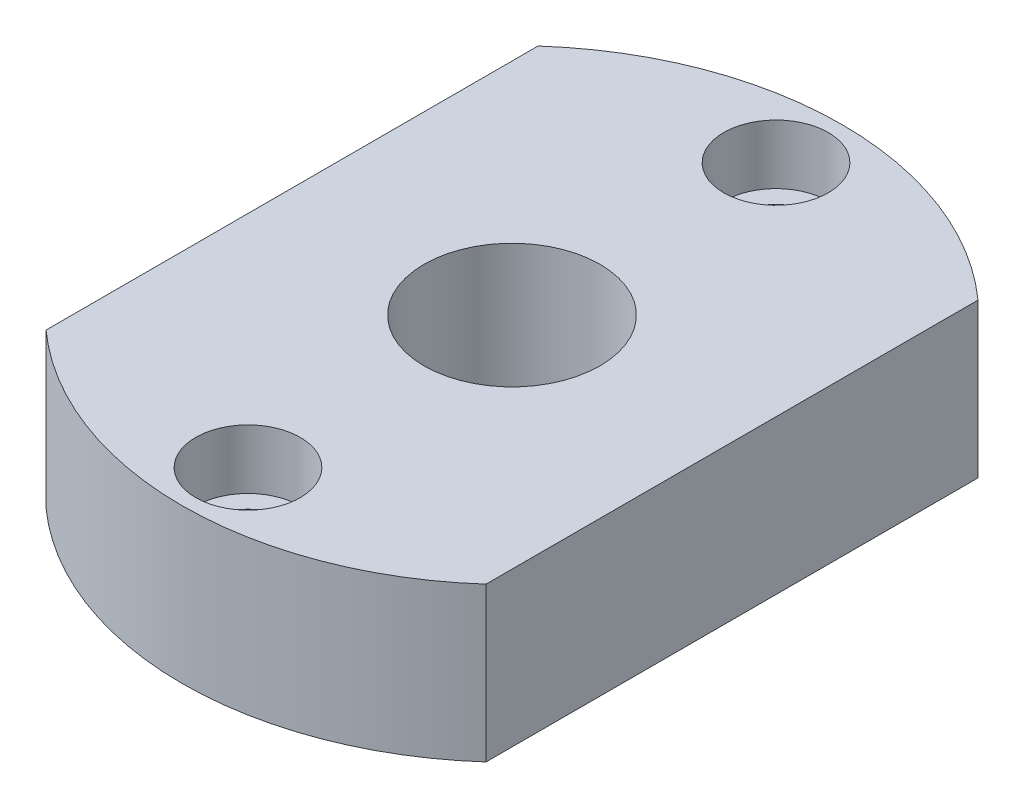
from build123d import *

# Parameters (mm, degrees)
SKETCH_1_R           = 30
EXTRUDE_1_DEPTH      = 14
SKETCH_2_R           = 8
CUT_EXTRUDE_1_DEPTH  = 14
SKETCH_3_R           = 3
CUT_EXTRUDE_2_DEPTH  = 14
SKETCH_4_R           = 4.75
CUT_EXTRUDE_3_DEPTH  = 5.4
SKETCH_5_OUTSIDE_W   = 79.2
SKETCH_5_OUTSIDE_H   = 79.2
SKETCH_5_OUTSIDE_W_2 = 40
SKETCH_5_OUTSIDE_H_2 = 65
CUT_EXTRUDE_4_DEPTH  = 14


with BuildPart() as part:
    # 草图1 → 凸台-拉伸1 (new body)
    with BuildSketch(Plane(origin=(0, 0, 0), x_dir=(1, 0, 0), z_dir=(0, 1, 0))):
        with Locations(Location((0, 0, 0), (0, 0, 270))):
            Circle(SKETCH_1_R)
    extrude(amount=EXTRUDE_1_DEPTH)

    # 草图2 → 切除-拉伸1 (cut)
    with BuildSketch(Plane(origin=(0, 14, 0), x_dir=(1, 0, 0), z_dir=(0, 1, 0))):
        with Locations(Location((0, 0, 0), (0, 0, 270))):
            Circle(SKETCH_2_R)
    extrude(amount=-CUT_EXTRUDE_1_DEPTH, mode=Mode.SUBTRACT)

    # 草图3 → 切除-拉伸2 (cut)
    with BuildSketch(Plane(origin=(0, 14, 0), x_dir=(1, 0, 0), z_dir=(0, 1, 0))):
        with Locations(Location((0, 24, 0), (0, 0, 270))):
            Circle(SKETCH_3_R)
        with Locations(Location((0, -24, 0), (0, 0, 90))):
            Circle(SKETCH_3_R)
    extrude(amount=-CUT_EXTRUDE_2_DEPTH, mode=Mode.SUBTRACT)

    # 草图4 → 切除-拉伸3 (cut)
    with BuildSketch(Plane(origin=(0, 14, 0), x_dir=(1, 0, 0), z_dir=(0, 1, 0))):
        with Locations(Location((0, 24, 0), (0, 0, 270))):
            Circle(SKETCH_4_R)
        with Locations(Location((0, -24, 0), (0, 0, 270))):
            Circle(SKETCH_4_R)
    extrude(amount=-CUT_EXTRUDE_3_DEPTH, mode=Mode.SUBTRACT)

    # 草图5 outside → 切除-拉伸4 (cut)
    with BuildSketch(Plane(origin=(0, 14, 0), x_dir=(1, 0, 0), z_dir=(0, 1, 0))):
        Rectangle(SKETCH_5_OUTSIDE_W, SKETCH_5_OUTSIDE_H)
        Rectangle(SKETCH_5_OUTSIDE_W_2, SKETCH_5_OUTSIDE_H_2, mode=Mode.SUBTRACT)
    extrude(amount=-CUT_EXTRUDE_4_DEPTH, mode=Mode.SUBTRACT)


solid = part.part
